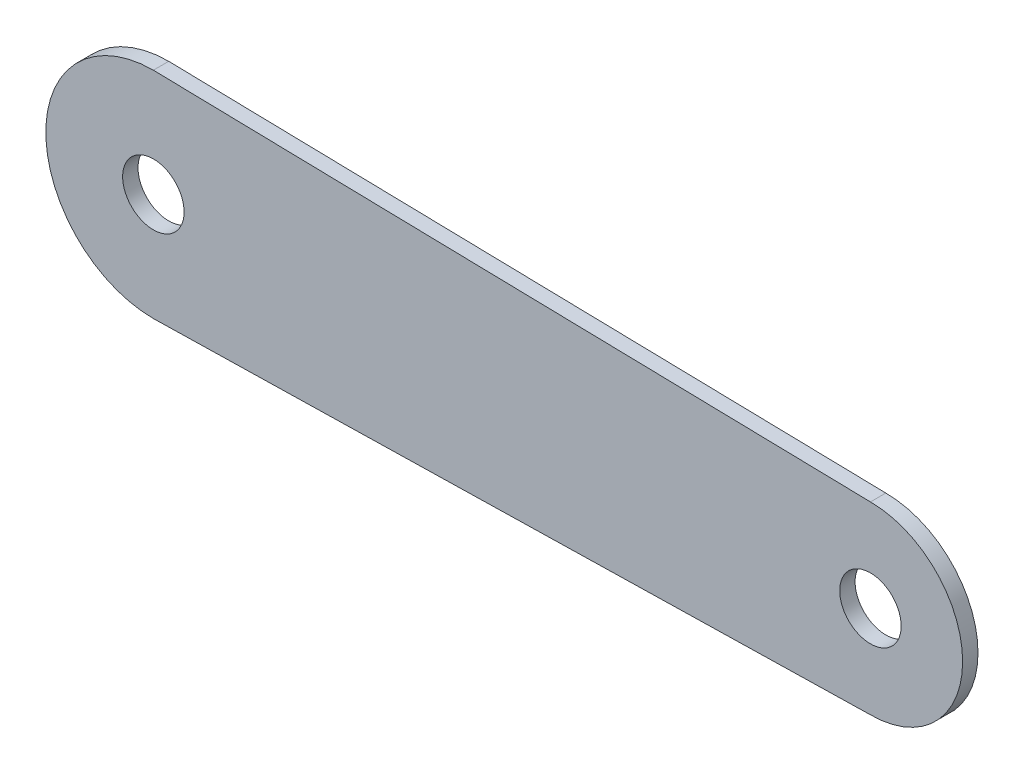
from build123d import *

# Parameters (mm, degrees)
SKETCH1_R           = 10
BOSS_EXTRUDE1_DEPTH = 5


with BuildPart() as part:
    # Sketch1 → Boss-Extrude1 (new body)
    with BuildSketch(Plane.XY):
        with BuildLine():
            Line((-100, 35), (133.333333333, 30))
            ThreePointArc((133.333333333, 30), (163.333333333, 0), (133.333333333, -30))
            Line((133.333333333, -30), (-100, -35))
            ThreePointArc((-100, -35), (-135, 0), (-100, 35))
        make_face()
        with Locations((-100, 0)):
            Circle(SKETCH1_R, mode=Mode.SUBTRACT)
        with Locations((133.333333333, 0)):
            Circle(SKETCH1_R, mode=Mode.SUBTRACT)
    extrude(amount=BOSS_EXTRUDE1_DEPTH)


solid = part.part
